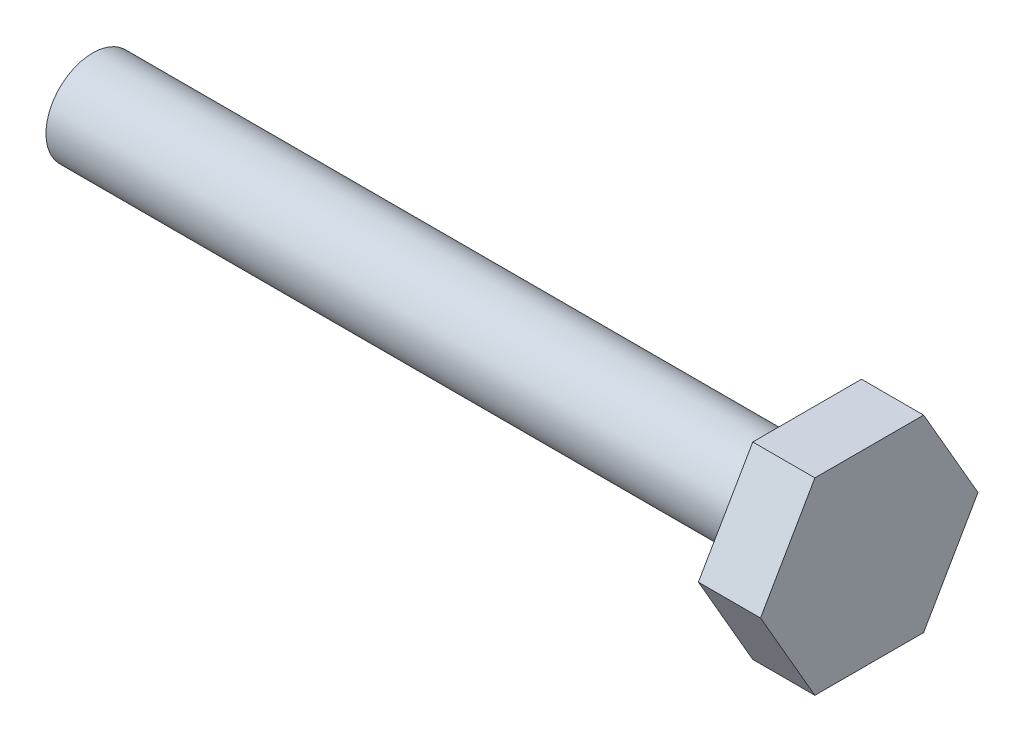
from build123d import *

# Parameters (mm, degrees)
WYTNIJ_WYCI_GNI_CIE2_DEPTH = 4


with BuildPart() as part:
    # Szkic1 → Obrót1 (revolve)
    with BuildSketch(Plane.XY):
        Polygon((0, 0), (-50, 0), (-50, 3), (-4, 3), (-4, 7), (0, 7), align=None)
    revolve(axis=Axis((0, 0, 0), (-1, 0, 0)))

    # Szkic3 → Wytnij-wyciągnięcie2 (cut)
    with BuildSketch(Plane(origin=(0, 0, 0), x_dir=(0, 0, -1), z_dir=(1, 0, 0))):
        with BuildLine():
            Line((-7, 0), (-3.5, 6.062177826))
            ThreePointArc((-3.5, 6.062177826), (-6.062177826, 3.5), (-7, 0))
        make_face()
        with BuildLine():
            Line((-3.5, 6.062177826), (3.5, 6.062177826))
            ThreePointArc((3.5, 6.062177826), (0, 7), (-3.5, 6.062177826))
        make_face()
        with BuildLine():
            Line((3.5, 6.062177826), (7, 0))
            ThreePointArc((7, 0), (6.062177826, 3.5), (3.5, 6.062177826))
        make_face()
        with BuildLine():
            ThreePointArc((3.5, -6.062177826), (6.062177826, -3.5), (7, 0))
            Line((7, 0), (3.5, -6.062177826))
        make_face()
        with BuildLine():
            ThreePointArc((-3.5, -6.062177826), (0, -7), (3.5, -6.062177826))
            Line((3.5, -6.062177826), (-3.5, -6.062177826))
        make_face()
        with BuildLine():
            ThreePointArc((-7, 0), (-6.062177826, -3.5), (-3.5, -6.062177826))
            Line((-3.5, -6.062177826), (-7, 0))
        make_face()
    extrude(amount=-WYTNIJ_WYCI_GNI_CIE2_DEPTH, mode=Mode.SUBTRACT)


solid = part.part
